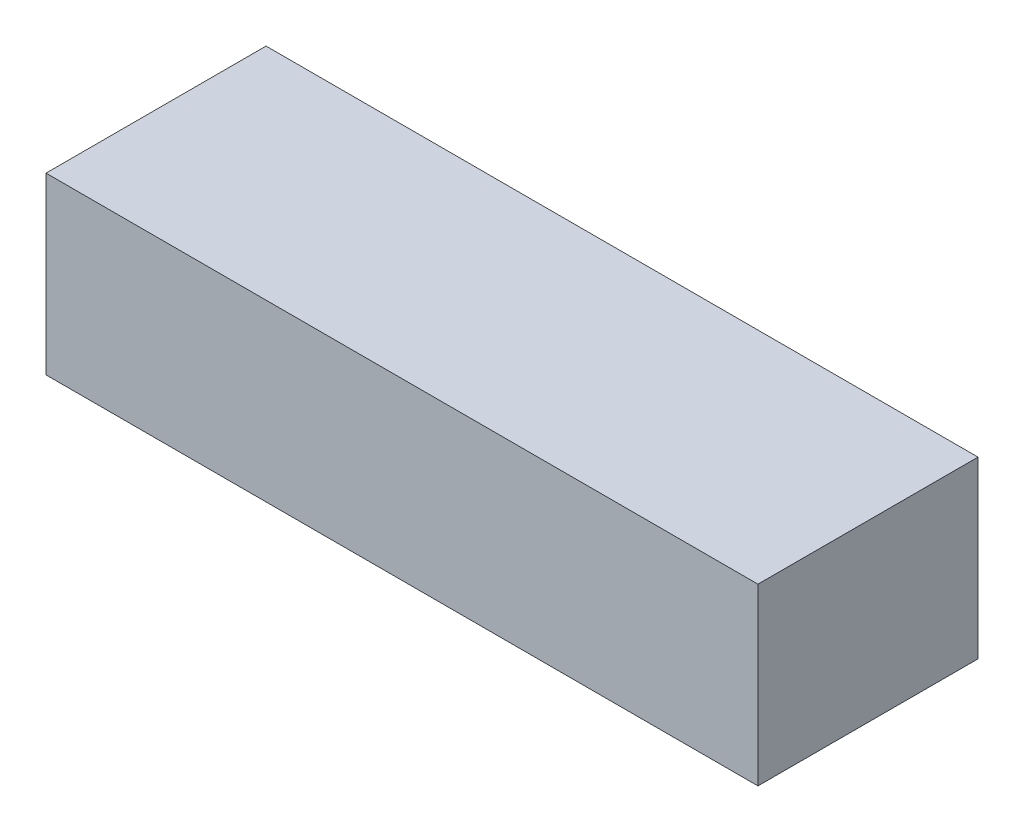
from build123d import *

# Parameters (mm, degrees)
SKETCH_1_W      = 110
SKETCH_1_H      = 34
EXTRUDE_1_DEPTH = 27


with BuildPart() as part:
    # 草图1 → 凸台-拉伸1 (new body)
    with BuildSketch(Plane(origin=(0, 0, 0), x_dir=(1, 0, 0), z_dir=(0, 1, 0))):
        Rectangle(SKETCH_1_W, SKETCH_1_H)
    extrude(amount=EXTRUDE_1_DEPTH)


solid = part.part
